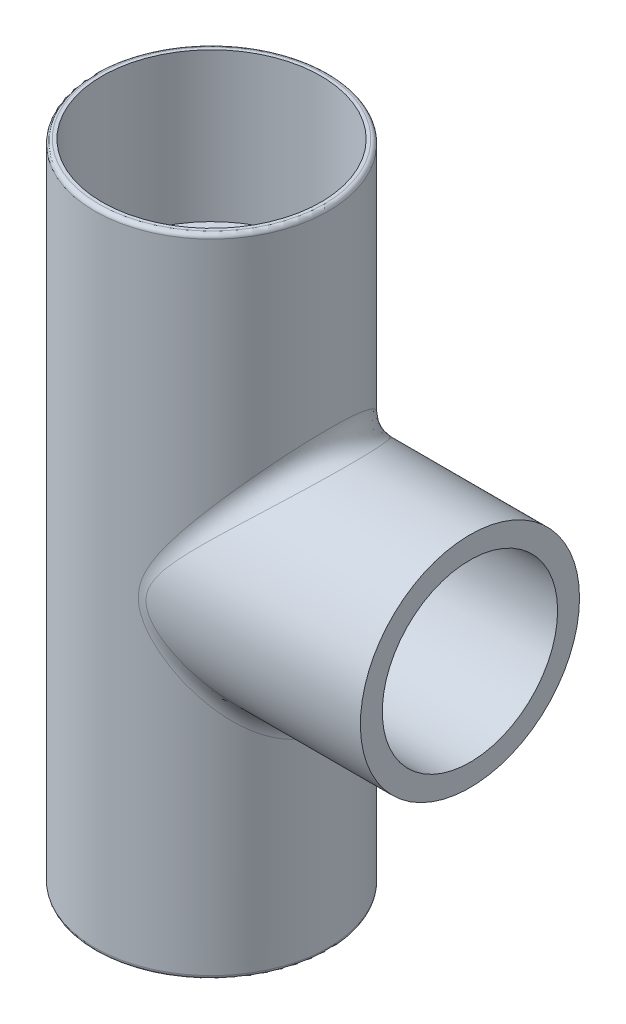
from build123d import *

# Parameters (mm, degrees)
SKETCH1_R           = 0.565
BOSS_EXTRUDE1_DEPTH = 3.125
SKETCH3_R           = 0.529
CUT_EXTRUDE2_DEPTH  = 0.72
CUT_EXTRUDE3_START  = -0.72
SKETCH4_R           = 0.529
CUT_EXTRUDE3_DEPTH  = 0.72
SKETCH5_R           = 0.53
BOSS_EXTRUDE2_DEPTH = 1.25
SKETCH6_R           = 0.311
CUT_EXTRUDE8_DEPTH  = 1.25
SKETCH9_R           = 0.424
CUT_EXTRUDE10_DEPTH = 0.69
SKETCH10_R          = 0.412
CUT_EXTRUDE12_DEPTH = 4.0625
FILLET1_R           = 0.02
FILLET2_R           = 0.1


with BuildPart() as part:
    # Sketch1 → Boss-Extrude1 (new body)
    with BuildSketch(Plane(origin=(0, 0, 0), x_dir=(1, 0, 0), z_dir=(0, 1, 0))):
        with Locations(Location((0, 0, 0), (0, 0, 270))):
            Circle(SKETCH1_R)
    extrude(amount=BOSS_EXTRUDE1_DEPTH)

    # Sketch3 → Cut-Extrude2 (cut)
    with BuildSketch(Plane.XZ):
        with Locations(Location((0, 0, 0), (0, 0, 270))):
            Circle(SKETCH3_R)
    extrude(amount=-CUT_EXTRUDE2_DEPTH, mode=Mode.SUBTRACT)

    # Sketch4 → Cut-Extrude3 (cut)
    with BuildSketch(Plane(origin=(0, 3.125, 0), x_dir=(1, 0, 0), z_dir=(0, 1, 0)).offset(CUT_EXTRUDE3_START)):
        with Locations(Location((0, 0, 0), (0, 0, 90))):
            Circle(SKETCH4_R)
    extrude(amount=CUT_EXTRUDE3_DEPTH, mode=Mode.SUBTRACT)

    # Sketch5 → Boss-Extrude2 (add)
    with BuildSketch(Plane(origin=(0, 0, 0), x_dir=(0, 0, -1), z_dir=(1, 0, 0))):
        with Locations(Location((0, 1.5625, 0), (0, 0, 180))):
            Circle(SKETCH5_R)
    extrude(amount=BOSS_EXTRUDE2_DEPTH)

    # Sketch6 → Cut-Extrude8 (cut)
    with BuildSketch(Plane(origin=(0, 0, 0), x_dir=(0, 0, -1), z_dir=(1, 0, 0))):
        with Locations((0, 1.5625)):
            Circle(SKETCH6_R)
    extrude(amount=CUT_EXTRUDE8_DEPTH, mode=Mode.SUBTRACT)

    # Sketch9 → Cut-Extrude10 (cut)
    with BuildSketch(Plane(origin=(1.25, 0, 0), x_dir=(0, 0, -1), z_dir=(1, 0, 0))):
        with Locations((0, 1.5625)):
            Circle(SKETCH9_R)
    extrude(amount=-CUT_EXTRUDE10_DEPTH, mode=Mode.SUBTRACT)

    # Sketch10 → Cut-Extrude12 (cut, symmetric)
    with BuildSketch(Plane(origin=(0, 2.405, 0), x_dir=(1, 0, 0), z_dir=(0, 1, 0))):
        with Locations(Location((0, 0, 0), (0, 0, 270))):
            Circle(SKETCH10_R)
    extrude(amount=CUT_EXTRUDE12_DEPTH, both=True, mode=Mode.SUBTRACT)

    # Fillet1
    fillet1_edges = [part.edges().sort_by_distance(p)[0] for p in [
        (0, 0, -0.565),
        (0, 3.125, -0.565),
    ]]
    fillet(fillet1_edges, radius=FILLET1_R)

    # Fillet2
    fillet2_edges = [part.edges().sort_by_distance(p)[0] for p in [
        (0.19576772, 1.5625, -0.53),
    ]]
    fillet(fillet2_edges, radius=FILLET2_R)


solid = part.part
